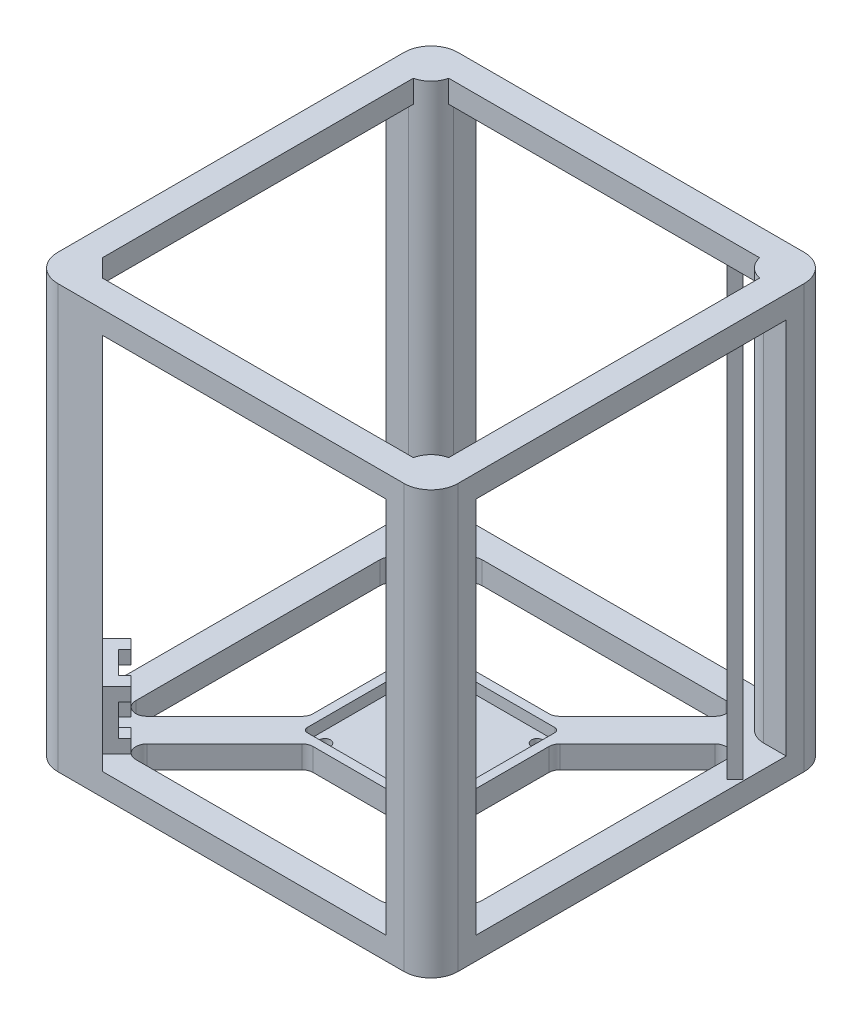
from build123d import *

# Parameters (mm, degrees)
SKETCH1_W                = 177.8
SKETCH1_H                = 177.8
BOSS_EXTRUDE1_DEPTH      = 10
FILLET1_R                = 12
CUT_EXTRUDE1_DEPTH       = 127.120656516
FILLET2_R                = 5
SKETCH3_R                = 2.5
CUT_EXTRUDE2_DEPTH       = 127.120656516
CUT_EXTRUDE3_DEPTH       = 5
SKETCH9_R                = 8
CUT_EXTRUDE6_DEPTH       = 126.822970876
BOSS_EXTRUDE2_DEPTH      = 26
BOSS_EXTRUDE2_DEPTH_BACK = 10
SKETCH7_W                = 6
SKETCH7_H                = 6
SKETCH7_R                = 1.55
BOSS_EXTRUDE3_DEPTH      = 4
SKETCH8_R                = 1.55
CUT_EXTRUDE5_DEPTH       = 227.781152687
BOSS_EXTRUDE4_START      = 167.8
BOSS_EXTRUDE4_DEPTH      = 167.8
FILLET3_R                = 10
BOSS_EXTRUDE5_START      = 10
BOSS_EXTRUDE5_DEPTH      = 10
BOSS_EXTRUDE6_REACH      = 219.76
BOSS_EXTRUDE7_REACH      = 219.76
CUT_EXTRUDE7_REACH       = 290.277
SKETCH15_R               = 2


with BuildPart() as part:
    # Sketch1 → Boss-Extrude1 (new body)
    with BuildSketch(Plane(origin=(0, 0, 0), x_dir=(1, 0, 0), z_dir=(0, 1, 0))):
        Rectangle(SKETCH1_W, SKETCH1_H)
    extrude(amount=BOSS_EXTRUDE1_DEPTH)

    # Fillet1
    fillet1_edges = [part.edges().sort_by_distance(p)[0] for p in [
        (-88.9, 5, -88.9),
        (88.9, 5, -88.9),
        (88.9, 5, 88.9),
        (-88.9, 5, 88.9),
    ]]
    fillet(fillet1_edges, radius=FILLET1_R)

    # Sketch2 → Cut-Extrude1 (cut, through all)
    with BuildSketch(Plane(origin=(0, 10, 0), x_dir=(1, 0, 0), z_dir=(0, 1, 0))):
        Polygon((-76.9, 66.293398282), (-32.5, 21.893398282), (-32.5, -21.893398282), (-76.9, -66.293398282), align=None)
        Polygon((-66.293398282, 76.9), (-21.893398282, 32.5), (21.893398282, 32.5), (66.293398282, 76.9), align=None)
        Polygon((76.9, 66.293398282), (32.5, 21.893398282), (32.5, -21.893398282), (76.9, -66.293398282), align=None)
        Polygon((66.293398282, -76.9), (21.893398282, -32.5), (-21.893398282, -32.5), (-66.293398282, -76.9), align=None)
    extrude(amount=-CUT_EXTRUDE1_DEPTH, mode=Mode.SUBTRACT)

    # Fillet2
    fillet2_edges = [part.edges().sort_by_distance(p)[0] for p in [
        (76.9, 5, 66.293398282),
        (32.5, 5, 21.893398282),
        (32.5, 5, -21.893398282),
        (76.9, 5, -66.293398282),
        (66.293398282, 5, -76.9),
        (21.893398282, 5, -32.5),
        (-21.893398282, 5, -32.5),
        (-66.293398282, 5, -76.9),
        (-66.293398282, 5, 76.9),
        (-21.893398282, 5, 32.5),
        (21.893398282, 5, 32.5),
        (66.293398282, 5, 76.9),
        (-76.9, 5, 66.293398282),
        (-76.9, 5, -66.293398282),
        (-32.5, 5, -21.893398282),
        (-32.5, 5, 21.893398282),
    ]]
    fillet(fillet2_edges, radius=FILLET2_R)

    # Sketch3 → Cut-Extrude2 (cut, through all)
    with BuildSketch(Plane(origin=(0, 10, 0), x_dir=(1, 0, 0), z_dir=(0, 1, 0))):
        with Locations(Location((-23.57, -23.57, 0), (0, 0, 270))):
            Circle(SKETCH3_R)
        with Locations(Location((23.57, 23.57, 0), (0, 0, 270))):
            Circle(SKETCH3_R)
        with Locations(Location((-23.57, 23.57, 0), (0, 0, 270))):
            Circle(SKETCH3_R)
        with Locations(Location((23.57, -23.57, 0), (0, 0, 270))):
            Circle(SKETCH3_R)
    extrude(amount=-CUT_EXTRUDE2_DEPTH, mode=Mode.SUBTRACT)

    # Sketch4 → Cut-Extrude3 (cut)
    with BuildSketch(Plane.XZ.offset(-10)):
        with BuildLine():
            Line((-26.5, 28.5), (26.5, 28.5))
            ThreePointArc((26.5, 28.5), (27.914213562, 27.914213562), (28.5, 26.5))
            Line((28.5, 26.5), (28.5, -26.5))
            ThreePointArc((28.5, -26.5), (27.914213562, -27.914213562), (26.5, -28.5))
            Line((26.5, -28.5), (-26.5, -28.5))
            ThreePointArc((-26.5, -28.5), (-27.914213562, -27.914213562), (-28.5, -26.5))
            Line((-28.5, -26.5), (-28.5, 26.5))
            ThreePointArc((-28.5, 26.5), (-27.914213562, 27.914213562), (-26.5, 28.5))
        make_face()
    extrude(amount=CUT_EXTRUDE3_DEPTH, mode=Mode.SUBTRACT)

    # Sketch9 → Cut-Extrude6 (cut, through all)
    with BuildSketch(Plane(origin=(0, 5, 0), x_dir=(1, 0, 0), z_dir=(0, 1, 0))):
        with Locations(Location((0, 0, 0), (0, 0, 270))):
            Circle(SKETCH9_R)
    extrude(amount=-CUT_EXTRUDE6_DEPTH, mode=Mode.SUBTRACT)

    # Sketch6 → Boss-Extrude2 (add, two sides: drawn at the far end of the back side and taken through both)
    with BuildSketch(Plane(origin=(0, 10, 0), x_dir=(1, 0, 0), z_dir=(0, 1, 0)).offset(-BOSS_EXTRUDE2_DEPTH_BACK)):
        Polygon((-82.153048327, -63.768272016), (-63.768272016, -82.153048327), (-60.23273811, -78.617514421), (-78.617514421, -60.23273811), align=None)
    extrude(amount=BOSS_EXTRUDE2_DEPTH + BOSS_EXTRUDE2_DEPTH_BACK)

    # Sketch7 → Boss-Extrude3 (add)
    # profile 1 of 4: a face of its own
    with BuildSketch(Plane(origin=(-69.425126266, 0, 69.425126266), x_dir=(-0.7071067811865478, 0, -0.7071067811865472), z_dir=(0.7071067811865472, 0, -0.7071067811865478))):
        with Locations((-10, 33)):
            Rectangle(SKETCH7_W, SKETCH7_H)
        with Locations((-10, 33)):
            Circle(SKETCH7_R, mode=Mode.SUBTRACT)
    # profile 2 of 4: a face of its own
    with BuildSketch(Plane(origin=(-69.425126266, 0, 69.425126266), x_dir=(-0.7071067811865478, 0, -0.7071067811865472), z_dir=(0.7071067811865472, 0, -0.7071067811865478))):
        with Locations((10, 13)):
            Rectangle(SKETCH7_W, SKETCH7_H)
        with Locations((10, 13)):
            Circle(SKETCH7_R, mode=Mode.SUBTRACT)
    # profile 3 of 4: a face of its own
    with BuildSketch(Plane(origin=(-69.425126266, 0, 69.425126266), x_dir=(-0.7071067811865478, 0, -0.7071067811865472), z_dir=(0.7071067811865472, 0, -0.7071067811865478))):
        with Locations((-10, 13)):
            Rectangle(SKETCH7_W, SKETCH7_H)
        with Locations((-10, 13)):
            Circle(SKETCH7_R, mode=Mode.SUBTRACT)
    # profile 4 of 4: a face of its own
    with BuildSketch(Plane(origin=(-69.425126266, 0, 69.425126266), x_dir=(-0.7071067811865478, 0, -0.7071067811865472), z_dir=(0.7071067811865472, 0, -0.7071067811865478))):
        with Locations((10, 33)):
            Rectangle(SKETCH7_W, SKETCH7_H)
        with Locations((10, 33)):
            Circle(SKETCH7_R, mode=Mode.SUBTRACT)
    extrude(amount=BOSS_EXTRUDE3_DEPTH)

    # Sketch8 → Cut-Extrude5 (cut, through all)
    with BuildSketch(Plane(origin=(-69.425126266, 0, 69.425126266), x_dir=(-0.7071067811865478, 0, -0.7071067811865472), z_dir=(0.7071067811865472, 0, -0.7071067811865478))):
        with Locations((-10, 13)):
            Circle(SKETCH8_R)
        with Locations((10, 13)):
            Circle(SKETCH8_R)
        with Locations((10, 33)):
            Circle(SKETCH8_R)
        with Locations((-10, 33)):
            Circle(SKETCH8_R)
    extrude(amount=-CUT_EXTRUDE5_DEPTH, mode=Mode.SUBTRACT)

    # Sketch10 → Boss-Extrude4 (add)
    with BuildSketch(Plane(origin=(0, 10, 0), x_dir=(1, 0, 0), z_dir=(0, 1, 0)).offset(BOSS_EXTRUDE4_START)):
        with BuildLine():
            Line((-68.9, -77.021320344), (-77.021320344, -68.9))
            Line((-77.021320344, -68.9), (-88.9, -68.9))
            Line((-88.9, -68.9), (-88.9, -76.9))
            ThreePointArc((-88.9, -76.9), (-85.385281374, -85.385281374), (-76.9, -88.9))
            Line((-76.9, -88.9), (-68.9, -88.9))
            Line((-68.9, -88.9), (-68.9, -77.021320344))
        make_face()
        with BuildLine():
            Line((-88.9, 76.9), (-88.9, 68.9))
            Line((-88.9, 68.9), (-68.9, 68.9))
            Line((-68.9, 68.9), (-68.9, 88.9))
            Line((-68.9, 88.9), (-76.9, 88.9))
            ThreePointArc((-76.9, 88.9), (-85.385281374, 85.385281374), (-88.9, 76.9))
        make_face()
        with BuildLine():
            Line((76.9, 88.9), (68.9, 88.9))
            Line((68.9, 88.9), (68.9, 68.9))
            Line((68.9, 68.9), (88.9, 68.9))
            Line((88.9, 68.9), (88.9, 76.9))
            ThreePointArc((88.9, 76.9), (85.385281374, 85.385281374), (76.9, 88.9))
        make_face()
        with BuildLine():
            Line((88.9, -76.9), (88.9, -68.9))
            Line((88.9, -68.9), (68.9, -68.9))
            Line((68.9, -68.9), (68.9, -88.9))
            Line((68.9, -88.9), (76.9, -88.9))
            ThreePointArc((76.9, -88.9), (85.385281374, -85.385281374), (88.9, -76.9))
        make_face()
    extrude(amount=-BOSS_EXTRUDE4_DEPTH)

    # Fillet3
    fillet3_edges = [part.edges().sort_by_distance(p)[0] for p in [
        (-68.9, 93.9, -68.9),
        (68.9, 93.9, -68.9),
        (68.9, 93.9, 68.9),
    ]]
    fillet(fillet3_edges, radius=FILLET3_R)

    # Sketch11 → Boss-Extrude5 (add)
    with BuildSketch(Plane(origin=(0, 177.8, 0), x_dir=(1, 0, 0), z_dir=(0, 1, 0)).offset(BOSS_EXTRUDE5_START)):
        with BuildLine():
            Line((88.9, -76.9), (88.9, 76.9))
            ThreePointArc((88.9, 76.9), (85.385281374, 85.385281374), (76.9, 88.9))
            Line((76.9, 88.9), (-76.9, 88.9))
            ThreePointArc((-76.9, 88.9), (-85.385281374, 85.385281374), (-88.9, 76.9))
            Line((-88.9, 76.9), (-88.9, -76.9))
            ThreePointArc((-88.9, -76.9), (-85.385281374, -85.385281374), (-76.9, -88.9))
            Line((-76.9, -88.9), (76.9, -88.9))
            ThreePointArc((76.9, -88.9), (85.385281374, -85.385281374), (88.9, -76.9))
        make_face()
        with BuildLine():
            Line((-69.021320344, -76.9), (69.102041029, -76.9))
            ThreePointArc((69.102041029, -76.9), (71.828932188, -71.828932188), (76.9, -69.102041029))
            Line((76.9, -69.102041029), (76.9, 69.102041029))
            ThreePointArc((76.9, 69.102041029), (71.828932188, 71.828932188), (69.102041029, 76.9))
            Line((69.102041029, 76.9), (-69.102041029, 76.9))
            ThreePointArc((-69.102041029, 76.9), (-71.828932188, 71.828932188), (-76.9, 69.102041029))
            Line((-76.9, 69.102041029), (-76.9, -69.021320344))
            Line((-76.9, -69.021320344), (-69.021320344, -76.9))
        make_face(mode=Mode.SUBTRACT)
    extrude(amount=-BOSS_EXTRUDE5_DEPTH)

    # Sketch13 → Boss-Extrude6 (add, up to next)
    with BuildSketch(Plane(origin=(0, 10, 0), x_dir=(1, 0, 0), z_dir=(0, 1, 0)), mode=Mode.PRIVATE) as boss_extrude6_sk1:
        Polygon((-88.9, -68.9), (-77.021320344, -68.9), (-88.9, -57.021320344), align=None)
    boss_extrude6_tool1 = extrude(boss_extrude6_sk1.sketch, amount=BOSS_EXTRUDE6_REACH, mode=Mode.PRIVATE) - part.part
    # Sketch13 → Boss-Extrude6 (add, up to next)
    with BuildSketch(Plane(origin=(0, 10, 0), x_dir=(1, 0, 0), z_dir=(0, 1, 0)), mode=Mode.PRIVATE) as boss_extrude6_sk2:
        Polygon((-68.9, -88.9), (-68.9, -77.021320344), (-57.021320344, -88.9), align=None)
    boss_extrude6_tool2 = extrude(boss_extrude6_sk2.sketch, amount=BOSS_EXTRUDE6_REACH, mode=Mode.PRIVATE) - part.part
    add(boss_extrude6_tool1.solids().sort_by_distance((-84.94044, 10, 64.94044))[0])
    add(boss_extrude6_tool2.solids().sort_by_distance((-64.94044, 10, 84.94044))[0])

    # Sketch14 → Boss-Extrude7 (add, up to next)
    with BuildSketch(Plane(origin=(0, 10, 0), x_dir=(1, 0, 0), z_dir=(0, 1, 0)), mode=Mode.PRIVATE) as boss_extrude7_sk1:
        Polygon((50.373088065, 88.203300859), (46.837554159, 84.667766953), (53.908621971, 77.596699141), (57.444155877, 81.132233047), align=None)
    boss_extrude7_tool1 = extrude(boss_extrude7_sk1.sketch, amount=BOSS_EXTRUDE7_REACH, mode=Mode.PRIVATE) - part.part
    # Sketch14 → Boss-Extrude7 (add, up to next)
    with BuildSketch(Plane(origin=(0, 10, 0), x_dir=(1, 0, 0), z_dir=(0, 1, 0)), mode=Mode.PRIVATE) as boss_extrude7_sk2:
        Polygon((77.596699141, 53.908621971), (81.132233047, 57.444155877), (88.203300859, 50.373088065), (84.667766953, 46.837554159), align=None)
    boss_extrude7_tool2 = extrude(boss_extrude7_sk2.sketch, amount=BOSS_EXTRUDE7_REACH, mode=Mode.PRIVATE) - part.part
    add(boss_extrude7_tool1.solids().sort_by_distance((52.140855, 10, -82.9))[0])
    add(boss_extrude7_tool2.solids().sort_by_distance((82.9, 10, -52.140855))[0])

    # Sketch15 → Cut-Extrude7 (cut, up to next)
    with BuildSketch(Plane(origin=(65.752660556, 0, -65.752660556), x_dir=(0.7071067811865449, 0, 0.7071067811865501), z_dir=(-0.7071067811865501, 0, 0.7071067811865449)), mode=Mode.PRIVATE) as cut_extrude7_sk1:
        with Locations((-21.75, 161.65)):
            Circle(SKETCH15_R)
    cut_extrude7_tool1 = extrude(cut_extrude7_sk1.sketch, amount=-CUT_EXTRUDE7_REACH, mode=Mode.PRIVATE) & part.part
    # Sketch15 → Cut-Extrude7 (cut, up to next)
    with BuildSketch(Plane(origin=(65.752660556, 0, -65.752660556), x_dir=(0.7071067811865449, 0, 0.7071067811865501), z_dir=(-0.7071067811865501, 0, 0.7071067811865449)), mode=Mode.PRIVATE) as cut_extrude7_sk2:
        with Locations((-21.75, 26.15)):
            Circle(SKETCH15_R)
    cut_extrude7_tool2 = extrude(cut_extrude7_sk2.sketch, amount=-CUT_EXTRUDE7_REACH, mode=Mode.PRIVATE) & part.part
    # Sketch15 → Cut-Extrude7 (cut, up to next)
    with BuildSketch(Plane(origin=(65.752660556, 0, -65.752660556), x_dir=(0.7071067811865449, 0, 0.7071067811865501), z_dir=(-0.7071067811865501, 0, 0.7071067811865449)), mode=Mode.PRIVATE) as cut_extrude7_sk3:
        with Locations((21.75, 26.15)):
            Circle(SKETCH15_R)
    cut_extrude7_tool3 = extrude(cut_extrude7_sk3.sketch, amount=-CUT_EXTRUDE7_REACH, mode=Mode.PRIVATE) & part.part
    # Sketch15 → Cut-Extrude7 (cut, up to next)
    with BuildSketch(Plane(origin=(65.752660556, 0, -65.752660556), x_dir=(0.7071067811865449, 0, 0.7071067811865501), z_dir=(-0.7071067811865501, 0, 0.7071067811865449)), mode=Mode.PRIVATE) as cut_extrude7_sk4:
        with Locations((21.75, 161.65)):
            Circle(SKETCH15_R)
    cut_extrude7_tool4 = extrude(cut_extrude7_sk4.sketch, amount=-CUT_EXTRUDE7_REACH, mode=Mode.PRIVATE) & part.part
    add(cut_extrude7_tool1.solids().sort_by_distance((50.373088, 161.65, -81.132233))[0], mode=Mode.SUBTRACT)
    add(cut_extrude7_tool2.solids().sort_by_distance((50.373088, 26.15, -81.132233))[0], mode=Mode.SUBTRACT)
    add(cut_extrude7_tool3.solids().sort_by_distance((81.132233, 26.15, -50.373088))[0], mode=Mode.SUBTRACT)
    add(cut_extrude7_tool4.solids().sort_by_distance((81.132233, 161.65, -50.373088))[0], mode=Mode.SUBTRACT)


solid = part.part
